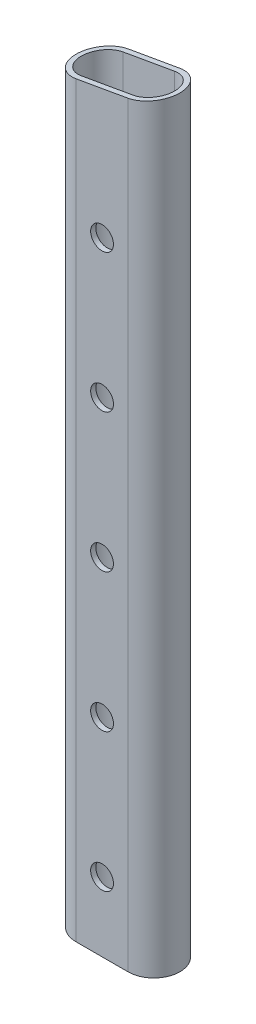
from build123d import *

# Parameters (mm, degrees)
EXTRUDE_1_DEPTH     = 220
SKETCH_2_R          = 3.3
CUT_EXTRUDE_1_DEPTH = 222.020361053


with BuildPart() as part:
    # Эскиз1 → Бобышка-Вытянуть1 (new body)
    with BuildSketch(Plane(origin=(0, 0, 0), x_dir=(1, 0, 0), z_dir=(0, 1, 0))):
        with BuildLine():
            Line((-7.5, 7.5), (7.5, 7.5))
            ThreePointArc((7.5, 7.5), (15, 0), (7.5, -7.5))
            Line((7.5, -7.5), (-7.5, -7.5))
            ThreePointArc((-7.5, -7.5), (-15, 0), (-7.5, 7.5))
        make_face()
        with BuildLine():
            Line((-7.5, 6), (7.5, 6))
            ThreePointArc((7.5, 6), (13.5, 0), (7.5, -6))
            Line((7.5, -6), (-7.5, -6))
            ThreePointArc((-7.5, -6), (-13.5, 0), (-7.5, 6))
        make_face(mode=Mode.SUBTRACT)
    extrude(amount=EXTRUDE_1_DEPTH)

    # Эскиз2 → Вырез-Вытянуть1 (cut, through all)
    with BuildSketch(Plane.XY.offset(7.5)):
        with Locations((0, 180)):
            Circle(SKETCH_2_R)
        with Locations((0, 140)):
            Circle(SKETCH_2_R)
        with Locations((0, 100)):
            Circle(SKETCH_2_R)
        with Locations((0, 60)):
            Circle(SKETCH_2_R)
        with Locations((0, 20)):
            Circle(SKETCH_2_R)
        Polygon((15, 220), (-15, 220), (-15, 214.710190579), align=None)
    extrude(amount=-CUT_EXTRUDE_1_DEPTH, mode=Mode.SUBTRACT)


solid = part.part
